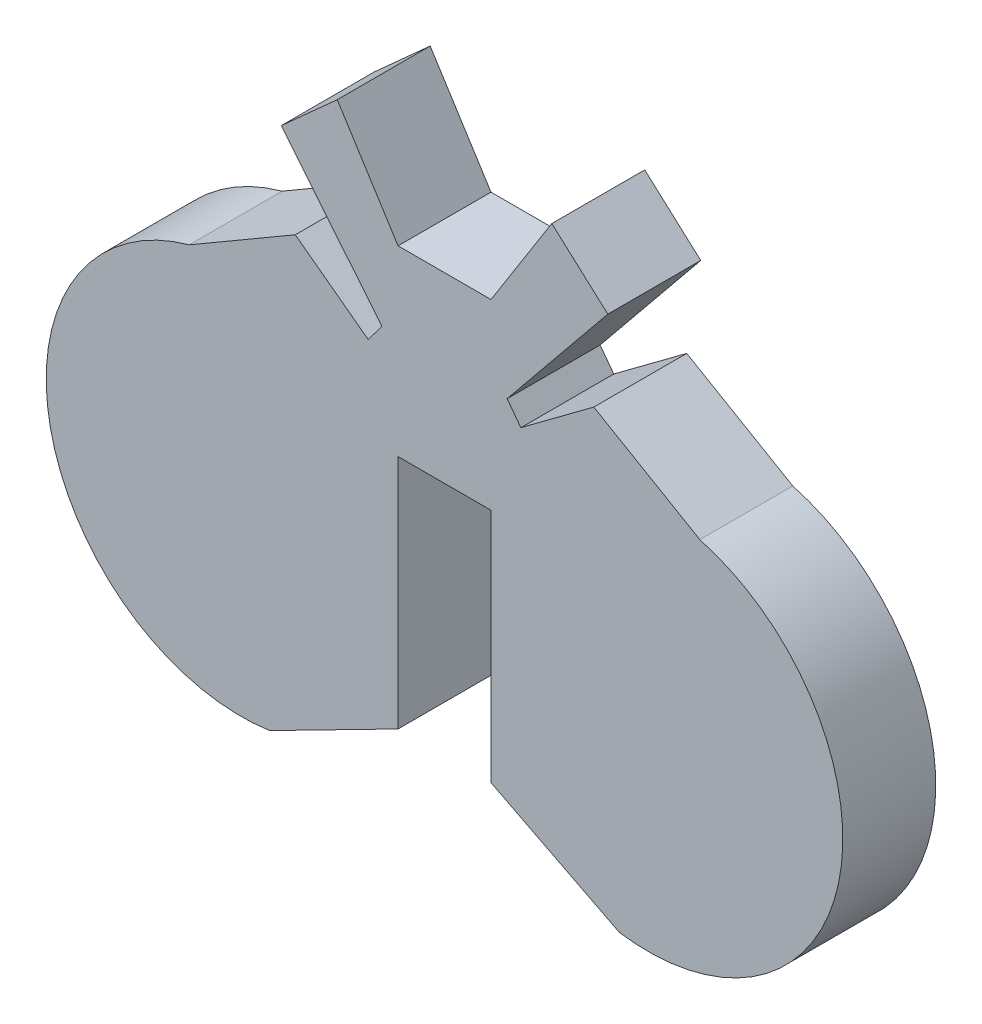
from build123d import *

# Parameters (mm, degrees)
BOSS_EXTRUDE1_DEPTH = 3
SKETCH2_W           = 3
SKETCH2_H           = 1
CUT_EXTRUDE1_DEPTH  = 10


with BuildPart() as part:
    # Sketch1 → Boss-Extrude1 (new body)
    with BuildSketch(Plane.XY):
        with BuildLine():
            Line((1.5, 6.891), (-1.5, 6.891))
            Line((-1.5, 6.891), (-3.462838736, 9.995543944))
            Line((-3.462838736, 9.995543944), (-5.270057432, 8.366602698))
            Line((-5.270057432, 8.366602698), (-2.022319198, 4.380080358))
            Line((-2.022319198, 4.380080358), (-2.462490424, 3.788964217))
            Line((-2.462490424, 3.788964217), (-4.816528245, 5.541884903))
            Line((-4.816528245, 5.541884903), (-8.240611079, 3.54862106))
            ThreePointArc((-8.240611079, 3.54862106), (-12.719726234, -3.813407871), (-5.642674559, -8.730447848))
            Line((-5.642674559, -8.730447848), (-1.5, -6.614))
            Line((-1.5, -6.614), (-1.5, 0))
            Line((-1.5, 0), (1.5, 0))
            Line((1.5, 0), (1.5, -6.614))
            Line((1.5, -6.614), (5.642674559, -8.730447848))
            ThreePointArc((5.642674559, -8.730447848), (12.719726234, -3.813407871), (8.240611079, 3.54862106))
            Line((8.240611079, 3.54862106), (4.816528245, 5.541884903))
            Line((4.816528245, 5.541884903), (2.462490424, 3.788964217))
            Line((2.462490424, 3.788964217), (2.022319198, 4.380080358))
            Line((2.022319198, 4.380080358), (5.270057432, 8.366602698))
            Line((5.270057432, 8.366602698), (3.462838736, 9.995543944))
            Line((3.462838736, 9.995543944), (1.5, 6.891))
        make_face()
    extrude(amount=-BOSS_EXTRUDE1_DEPTH)

    # Sketch2 → Cut-Extrude1 (cut)
    with BuildSketch(Plane.XY):
        with Locations((0, 0.5)):
            Rectangle(SKETCH2_W, SKETCH2_H)
    extrude(amount=-CUT_EXTRUDE1_DEPTH, mode=Mode.SUBTRACT)


solid = part.part
